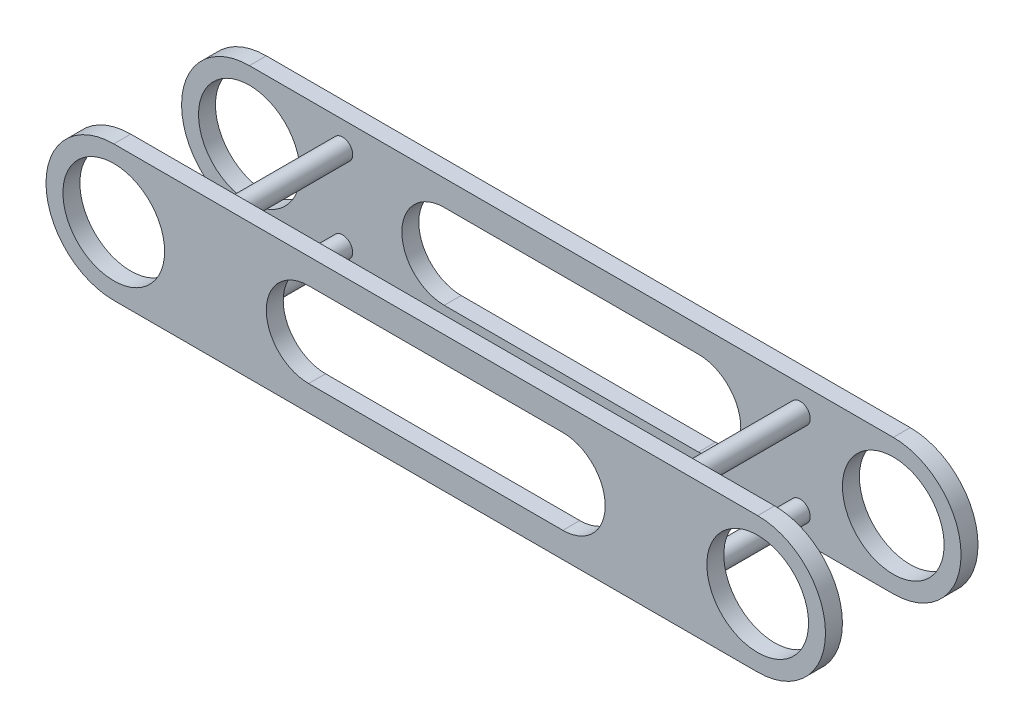
from build123d import *

# Parameters (mm, degrees)
SKETCH1_R           = 30
BOSS_EXTRUDE1_DEPTH = 52.5
BOSS_EXTRUDE2_DEPTH = 10
CUT_EXTRUDE1_REACH  = 435.02
SKETCH5_R           = 30
BOSS_EXTRUDE3_DEPTH = 52.5
SKETCH6_R           = 6
BOSS_EXTRUDE4_DEPTH = 80
SKETCH7_R           = 30
CUT_EXTRUDE2_DEPTH  = 435.770054167


with BuildPart() as part:
    # Sketch1 → Boss-Extrude1 (new, symmetric)
    with BuildSketch(Plane.XY):
        Circle(SKETCH1_R)
    extrude(amount=BOSS_EXTRUDE1_DEPTH, both=True)

    # Sketch2 → Boss-Extrude2 (add)
    with BuildSketch(Plane.XY.offset(45)):
        with BuildLine():
            Line((0, 40), (380, 40))
            ThreePointArc((380, 40), (420, 0), (380, -40))
            Line((380, -40), (0, -40))
            ThreePointArc((0, -40), (-40, 0), (0, 40))
        make_face()
    boss_extrude2 = extrude(amount=-BOSS_EXTRUDE2_DEPTH)

    # Sketch4 → Cut-Extrude1 (cut, up to next)
    with BuildSketch(Plane.XY.offset(45), mode=Mode.PRIVATE) as cut_extrude1_sk1:
        with BuildLine():
            Line((265, -25), (115, -25))
            ThreePointArc((115, -25), (90, 0), (115, 25))
            Line((115, 25), (265, 25))
            ThreePointArc((265, 25), (290, 0), (265, -25))
        make_face()
    cut_extrude1_tool1 = extrude(cut_extrude1_sk1.sketch, amount=-CUT_EXTRUDE1_REACH, mode=Mode.PRIVATE) & part.part
    cut_extrude1 = cut_extrude1_tool1.solids().sort_by_distance((190, 0, 45))[0]
    add(cut_extrude1, mode=Mode.SUBTRACT)

    # Sketch5 → Boss-Extrude3 (add, symmetric)
    with BuildSketch(Plane.XY):
        with Locations((380, 0)):
            Circle(SKETCH5_R)
    extrude(amount=BOSS_EXTRUDE3_DEPTH, both=True)

    # Mirror1: Boss-Extrude2, Cut-Extrude1 across plane
    add(boss_extrude2.mirror(Plane.XY))
    add(cut_extrude1.mirror(Plane.XY), mode=Mode.SUBTRACT)

    # Sketch6 → Boss-Extrude4 (add)
    with BuildSketch(Plane.XY.offset(45)):
        with Locations((55, 25)):
            Circle(SKETCH6_R)
        with Locations((55, -25)):
            Circle(SKETCH6_R)
        with Locations((325, -25)):
            Circle(SKETCH6_R)
        with Locations((325, 25)):
            Circle(SKETCH6_R)
    extrude(amount=-BOSS_EXTRUDE4_DEPTH)

    # Sketch7 → Cut-Extrude2 (cut, through all)
    with BuildSketch(Plane.XY.offset(52.5)):
        with Locations((380, 0)):
            Circle(SKETCH7_R)
        Circle(SKETCH7_R)
    extrude(amount=-CUT_EXTRUDE2_DEPTH, mode=Mode.SUBTRACT)


solid = part.part
